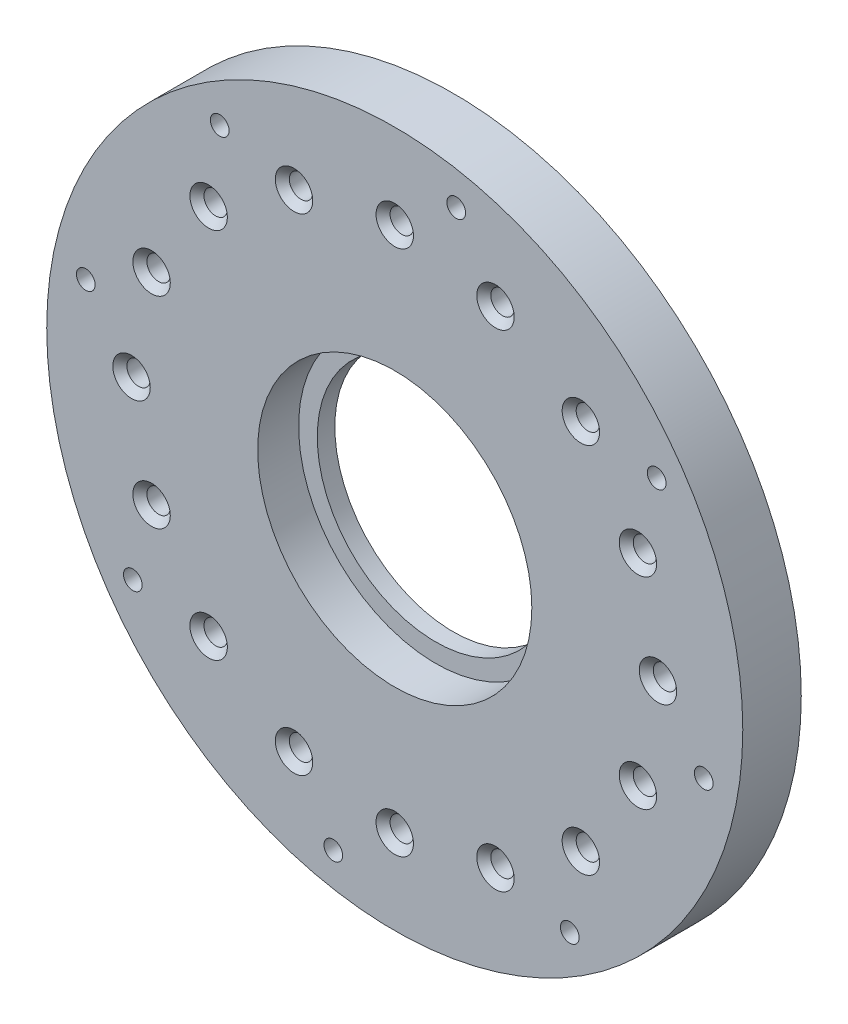
from build123d import *

# Parameters (mm, degrees)
SKETCH3_R           = 59.5
BOSS_EXTRUDE1_DEPTH = 10
SKETCH4_R           = 1.6
CUT_EXTRUDE1_DEPTH  = 85.737830985
SKETCH5_R           = 2
CUT_EXTRUDE2_DEPTH  = 5
SKETCH6_R           = 2.9
CUT_EXTRUDE3_DEPTH  = 3
SKETCH7_R           = 23.435
CUT_EXTRUDE4_DEPTH  = 7
SKETCH8_R           = 20.25
CUT_EXTRUDE5_DEPTH  = 85.737830985
CHAMFER1_SIZE       = 1.2


with BuildPart() as part:
    # Sketch3 → Boss-Extrude1 (new body)
    with BuildSketch(Plane.XY):
        Circle(SKETCH3_R)
    extrude(amount=BOSS_EXTRUDE1_DEPTH)

    # Sketch4 → Cut-Extrude1 (cut, through all)
    with BuildSketch(Plane.XY.offset(10)):
        with Locations((44.782953319, 29.92301275)):
            Circle(SKETCH4_R)
        with Locations((52.825095203, -10.507564744)):
            Circle(SKETCH4_R)
        with Locations((29.92301275, -44.782953319)):
            Circle(SKETCH4_R)
        with Locations((-10.507564744, -52.825095203)):
            Circle(SKETCH4_R)
        with Locations((-44.782953319, -29.92301275)):
            Circle(SKETCH4_R)
        with Locations((-52.825095203, 10.507564744)):
            Circle(SKETCH4_R)
        with Locations((-29.92301275, 44.782953319)):
            Circle(SKETCH4_R)
        with Locations((10.507564744, 52.825095203)):
            Circle(SKETCH4_R)
    extrude(amount=-CUT_EXTRUDE1_DEPTH, mode=Mode.SUBTRACT)

    # Sketch5 → Cut-Extrude2 (cut)
    with BuildSketch(Plane.XY.offset(10)):
        with Locations((45, 0)):
            Circle(SKETCH5_R)
        with Locations((41.574578963, -17.220754456)):
            Circle(SKETCH5_R)
        with Locations((31.819805153, -31.819805153)):
            Circle(SKETCH5_R)
        with Locations((17.220754456, -41.574578963)):
            Circle(SKETCH5_R)
        with Locations((0, -45)):
            Circle(SKETCH5_R)
        with Locations((-17.220754456, -41.574578963)):
            Circle(SKETCH5_R)
        with Locations((-31.819805153, -31.819805153)):
            Circle(SKETCH5_R)
        with Locations((-41.574578963, -17.220754456)):
            Circle(SKETCH5_R)
        with Locations((-45, 0)):
            Circle(SKETCH5_R)
        with Locations((-41.574578963, 17.220754456)):
            Circle(SKETCH5_R)
        with Locations((-31.819805153, 31.819805153)):
            Circle(SKETCH5_R)
        with Locations((-17.220754456, 41.574578963)):
            Circle(SKETCH5_R)
        with Locations((0, 45)):
            Circle(SKETCH5_R)
        with Locations((17.220754456, 41.574578963)):
            Circle(SKETCH5_R)
        with Locations((31.819805153, 31.819805153)):
            Circle(SKETCH5_R)
        with Locations((41.574578963, 17.220754456)):
            Circle(SKETCH5_R)
    extrude(amount=-CUT_EXTRUDE2_DEPTH, mode=Mode.SUBTRACT)

    # Sketch6 → Cut-Extrude3 (cut)
    with BuildSketch(Plane(origin=(0, 0, 0), x_dir=(-1, 0, 0), z_dir=(0, 0, -1))):
        with Locations((52.825095203, 10.507564744)):
            Circle(SKETCH6_R)
        with Locations((44.782953319, -29.92301275)):
            Circle(SKETCH6_R)
        with Locations((10.507564744, -52.825095203)):
            Circle(SKETCH6_R)
        with Locations((-29.92301275, -44.782953319)):
            Circle(SKETCH6_R)
        with Locations((-52.825095203, -10.507564744)):
            Circle(SKETCH6_R)
        with Locations((-44.782953319, 29.92301275)):
            Circle(SKETCH6_R)
        with Locations((-10.507564744, 52.825095203)):
            Circle(SKETCH6_R)
        with Locations((29.92301275, 44.782953319)):
            Circle(SKETCH6_R)
    extrude(amount=-CUT_EXTRUDE3_DEPTH, mode=Mode.SUBTRACT)

    # Sketch7 → Cut-Extrude4 (cut)
    with BuildSketch(Plane.XY.offset(10)):
        Circle(SKETCH7_R)
    extrude(amount=-CUT_EXTRUDE4_DEPTH, mode=Mode.SUBTRACT)

    # Sketch8 → Cut-Extrude5 (cut, through all)
    with BuildSketch(Plane.XY.offset(10)):
        Circle(SKETCH8_R)
    extrude(amount=-CUT_EXTRUDE5_DEPTH, mode=Mode.SUBTRACT)

    # Chamfer1
    chamfer1_edges = [part.edges().sort_by_distance(p)[0] for p in [
        (39.574578963, 17.220754456, 10),
        (29.819805153, 31.819805153, 10),
        (15.220754456, 41.574578963, 10),
        (-2, 45, 10),
        (-19.220754456, 41.574578963, 10),
        (-33.819805153, 31.819805153, 10),
        (-43.574578963, 17.220754456, 10),
        (-47, 0, 10),
        (-43.574578963, -17.220754456, 10),
        (-33.819805153, -31.819805153, 10),
        (-19.220754456, -41.574578963, 10),
        (-2, -45, 10),
        (15.220754456, -41.574578963, 10),
        (29.819805153, -31.819805153, 10),
        (39.574578963, -17.220754456, 10),
        (43, 0, 10),
    ]]
    chamfer(chamfer1_edges, length=CHAMFER1_SIZE)


solid = part.part
